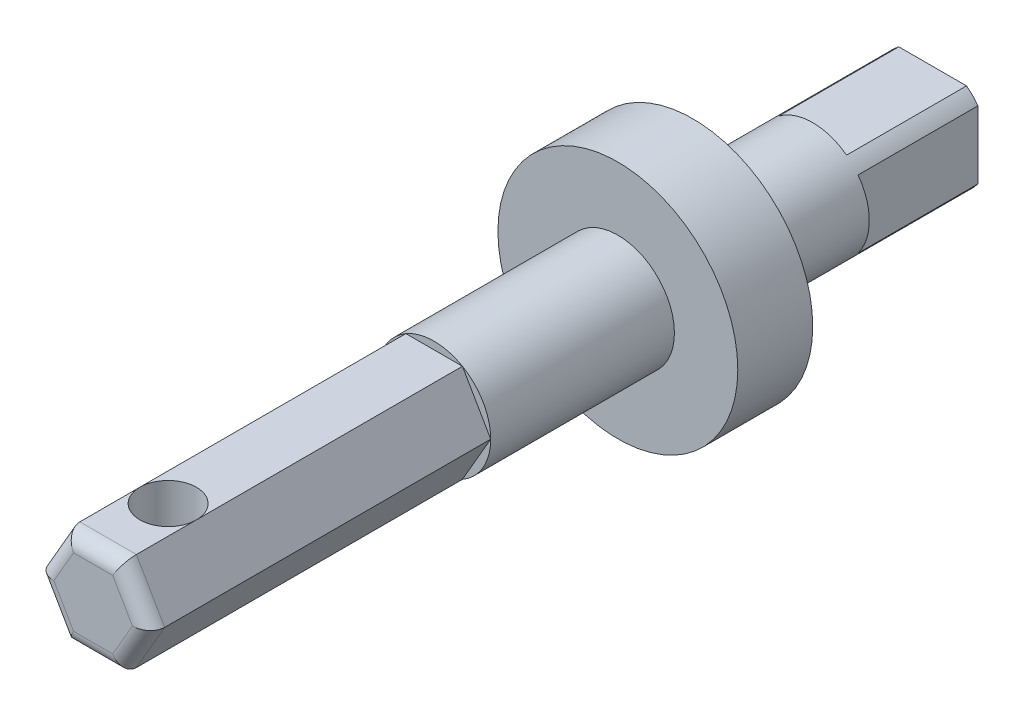
from build123d import *
from build123d.topology import SkipClean

# Parameters (mm, degrees)
BOSS_EXTRUDE1_DEPTH = 8.25
BOSS_EXTRUDE2_DEPTH = 7.75
BOSS_EXTRUDE3_START = -8
SKETCH3_R           = 3.773
BOSS_EXTRUDE3_DEPTH = 8
BOSS_EXTRUDE4_DEPTH = 30
SKETCH6_R           = 3.773
BOSS_EXTRUDE5_DEPTH = 10
SKETCH7_R           = 3.773
BOSS_EXTRUDE6_DEPTH = 7.254
BOSS_EXTRUDE7_DEPTH = 10
SKETCH9_R           = 8
BOSS_EXTRUDE8_DEPTH = 5
SKETCH10_R          = 1.8865
CUT_EXTRUDE1_DEPTH  = 58.679779
FILLET1_R           = 1


with BuildPart() as part:
    # Sketch1 → Boss-Extrude1 (new body)
    with BuildSketch(Plane.XY):
        with BuildLine():
            Line((-2.257654, 3.023), (2.257654, 3.023))
            ThreePointArc((2.257654, 3.023), (2.667914, 2.667914), (3.023, 2.257654))
            Line((3.023, 2.257654), (3.023, -2.257654))
            ThreePointArc((3.023, -2.257654), (-2.667914, -2.667914), (-2.257654, 3.023))
        make_face()
        with BuildLine():
            Line((-2.892696, -0.20569), (0.20569, 2.892696))
            ThreePointArc((0.20569, 2.892696), (2.05061, 2.05061), (2.892696, 0.20569))
            Line((2.892696, 0.20569), (-0.20569, -2.892696))
            ThreePointArc((-0.20569, -2.892696), (-2.05061, -2.05061), (-2.892696, -0.20569))
        make_face(mode=Mode.SUBTRACT)
    extrude(amount=BOSS_EXTRUDE1_DEPTH)

    # Sketch2 → Boss-Extrude2 (add)
    with SkipClean():  # the faces are left unmerged after this step: merging them gives an invalid solid
        with BuildSketch(Plane.XY.offset(8.25)):
            with BuildLine():
                Line((2.257654, 3.023), (-2.257654, 3.023))
                ThreePointArc((-2.257654, 3.023), (-2.667914, -2.667914), (3.023, -2.257654))
                Line((3.023, -2.257654), (3.023, 2.257654))
                ThreePointArc((3.023, 2.257654), (2.667914, 2.667914), (2.257654, 3.023))
            make_face()
        extrude(amount=BOSS_EXTRUDE2_DEPTH)

    # Sketch3 → Boss-Extrude3 (add)
    with BuildSketch(Plane.XY.offset(16).offset(BOSS_EXTRUDE3_START)):
        with Locations(Location((0, 0, 0), (0, 0, 126.753315))):
            Circle(SKETCH3_R)
    extrude(amount=BOSS_EXTRUDE3_DEPTH)

    # Sketch5 → Boss-Extrude4 (add)
    with BuildSketch(Plane.XY.offset(16)):
        Polygon((1.8865, 3.267514), (-1.8865, 3.267514), (-3.773, 0), (-1.8865, -3.267514), (1.8865, -3.267514), (3.773, 0), align=None)
    extrude(amount=BOSS_EXTRUDE4_DEPTH)

    # Sketch6 → Boss-Extrude5 (add)
    with BuildSketch(Plane.XY.offset(16)):
        with Locations(Location((0, 0, 0), (0, 0, 180))):
            Circle(SKETCH6_R)
    extrude(amount=BOSS_EXTRUDE5_DEPTH)

    # Sketch7 → Boss-Extrude6 (add)
    with BuildSketch(Plane.XY.offset(26)):
        with Locations(Location((0, 0, 0), (0, 0, 180))):
            Circle(SKETCH7_R)
    extrude(amount=BOSS_EXTRUDE6_DEPTH)

    # Sketch8 → Boss-Extrude7 (add)
    with BuildSketch(Plane.XY.offset(46)):
        Polygon((3.773, 0), (1.8865, 3.267514), (-1.8865, 3.267514), (-3.773, 0), (-1.8865, -3.267514), (1.8865, -3.267514), align=None)
    extrude(amount=BOSS_EXTRUDE7_DEPTH)

    # Sketch9 → Boss-Extrude8 (add)
    with BuildSketch(Plane.XY.offset(21)):
        Circle(SKETCH9_R)
    extrude(amount=-BOSS_EXTRUDE8_DEPTH)

    # Sketch10 → Cut-Extrude1 (cut, through all)
    with BuildSketch(Plane(origin=(0, 3.267514, 0), x_dir=(1, 0, 0), z_dir=(0, 1, 0))):
        with Locations(Location((0, -51, 0), (0, 0, 180))):
            Circle(SKETCH10_R)
    extrude(amount=-CUT_EXTRUDE1_DEPTH, mode=Mode.SUBTRACT)

    # Fillet1
    fillet1_edges = [part.edges().sort_by_distance(p)[0] for p in [
        (2.82975, -1.633757, 56),
        (2.82975, 1.633757, 56),
        (0, 3.267514, 56),
        (-2.82975, 1.633757, 56),
        (-2.82975, -1.633757, 56),
        (0, -3.267514, 56),
    ]]
    fillet(fillet1_edges, radius=FILLET1_R)


solid = part.part
